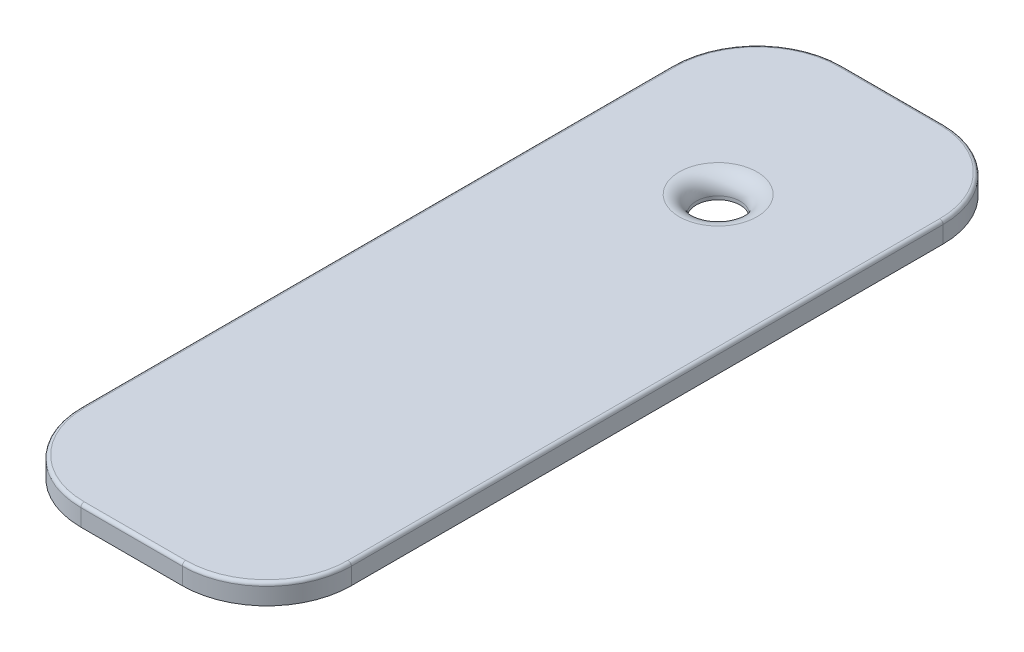
from build123d import *

# Parameters (mm, degrees)
EXTRUDE_1_DEPTH     = 6
FILLET_1_R          = 1
SKETCH_2_R          = 6.5
CUT_EXTRUDE_1_DEPTH = 179.931854445
FILLET_2_R          = 5


with BuildPart() as part:
    # 草图1 → 凸台-拉伸1 (new body)
    with BuildSketch(Plane(origin=(0, 0, 0), x_dir=(1, 0, 0), z_dir=(0, 1, 0))):
        with BuildLine():
            Line((-11.483876828, 51.544081798), (18.516123172, 51.544081798))
            ThreePointArc((18.516123172, 51.544081798), (36.193792702, 44.221751328), (43.516123172, 26.544081798))
            Line((43.516123172, 26.544081798), (43.516123172, -148.455918202))
            ThreePointArc((43.516123172, -148.455918202), (36.193792702, -166.133587732), (18.516123172, -173.455918202))
            Line((18.516123172, -173.455918202), (-11.483876828, -173.455918202))
            ThreePointArc((-11.483876828, -173.455918202), (-29.161546358, -166.133587732), (-36.483876828, -148.455918202))
            Line((-36.483876828, -148.455918202), (-36.483876828, 26.544081798))
            ThreePointArc((-36.483876828, 26.544081798), (-29.161546358, 44.221751328), (-11.483876828, 51.544081798))
        make_face()
    extrude(amount=EXTRUDE_1_DEPTH)

    # 圆角1
    fillet_1_edges = [part.edges().sort_by_distance(p)[0] for p in [
        (36.193792702, 6, -44.221751328),
        (3.516123172, 6, -51.544081798),
        (-29.161546358, 6, -44.221751328),
        (-36.483876828, 6, 60.955918202),
        (-29.161546358, 6, 166.133587732),
        (3.516123172, 6, 173.455918202),
        (36.193792702, 6, 166.133587732),
        (43.516123172, 6, 60.955918202),
    ]]
    fillet(fillet_1_edges, radius=FILLET_1_R)

    # 草图2 → 切除-拉伸1 (cut, through all)
    with BuildSketch(Plane(origin=(0, 6, 0), x_dir=(1, 0, 0), z_dir=(0, 1, 0))):
        with Locations(Location((3.516123172, 0, 0), (0, 0, 270))):
            Circle(SKETCH_2_R)
    extrude(amount=-CUT_EXTRUDE_1_DEPTH, mode=Mode.SUBTRACT)

    # 圆角2
    fillet_2_edges = [part.edges().sort_by_distance(p)[0] for p in [
        (3.516123172, 6, -6.5),
    ]]
    fillet(fillet_2_edges, radius=FILLET_2_R)


solid = part.part
